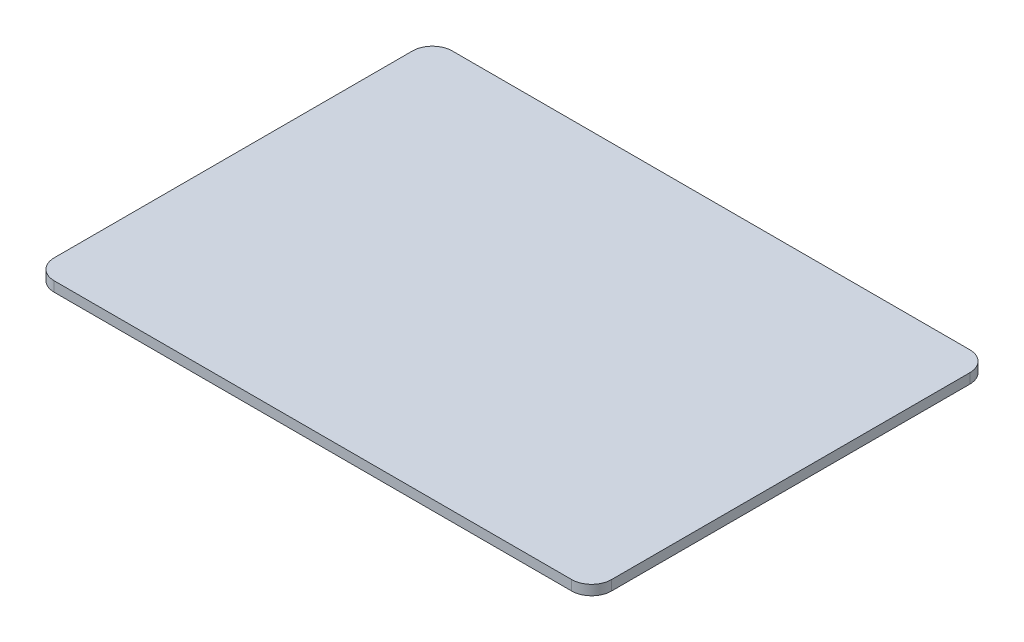
from build123d import *

# Parameters (mm, degrees)
ESQUISSE1_W        = 355.6
ESQUISSE1_H        = 254
BOSS_EXTRU_1_DEPTH = 6.35
CONG_1_R           = 12.7


with BuildPart() as part:
    # Esquisse1 → Boss.-Extru.1 (new body)
    with BuildSketch(Plane(origin=(0, 0, 0), x_dir=(1, 0, 0), z_dir=(0, 1, 0))):
        Rectangle(ESQUISSE1_W, ESQUISSE1_H)
    extrude(amount=BOSS_EXTRU_1_DEPTH)

    # Congé1
    cong_1_edges = [part.edges().sort_by_distance(p)[0] for p in [
        (177.8, 3.175, 127),
        (-177.8, 3.175, 127),
        (-177.8, 3.175, -127),
        (177.8, 3.175, -127),
    ]]
    fillet(cong_1_edges, radius=CONG_1_R)


solid = part.part
